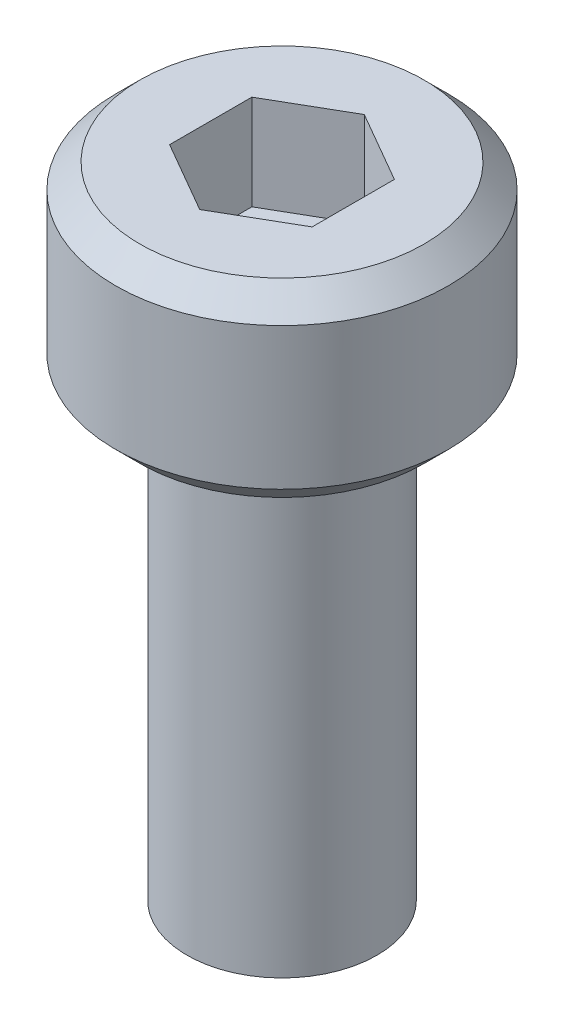
from build123d import *

# Parameters (mm, degrees)
SKETCH1_W           = 3.5
SKETCH1_H           = 3.999992
SKETCH2_R           = 2
BOSS_EXTRUDE1_DEPTH = 10
CUT_EXTRUDE1_DEPTH  = 2
CHAMFER1_SIZE       = 0.508
CHAMFER2_SIZE       = 0.76962
CHAMFER2_SIZE2      = 0.53848


with BuildPart() as part:
    # Sketch1 → Revolve1 (revolve)
    with BuildSketch(Plane.XY):
        with Locations((1.75, 1.999996)):
            Rectangle(SKETCH1_W, SKETCH1_H)
    revolve(axis=Axis((0, 3.999992, 0), (0, -1, 0)))

    # Sketch2 → Boss-Extrude1 (add)
    with BuildSketch(Plane.XZ):
        Circle(SKETCH2_R)
    extrude(amount=BOSS_EXTRUDE1_DEPTH)

    # Sketch3 → Cut-Extrude1 (cut)
    with BuildSketch(Plane(origin=(0, 3.999992, 0), x_dir=(-1, 0, 0), z_dir=(0, 1, 0))):
        Polygon((-1.5, -0.866025404), (0, -1.732050808), (1.5, -0.866025404), (1.5, 0.866025404), (0, 1.732050808), (-1.5, 0.866025404), align=None)
    extrude(amount=-CUT_EXTRUDE1_DEPTH, mode=Mode.SUBTRACT)

    # Chamfer1
    chamfer1_edges = [part.edges().sort_by_distance(p)[0] for p in [
        (-3.5, 0, 0),
        (-3.5, 3.999992, 0),
    ]]
    chamfer(chamfer1_edges, length=CHAMFER1_SIZE)

    # Chamfer2
    chamfer2_edges = [part.edges().sort_by_distance(p)[0] for p in [
        (-2, -10, 0),
    ]]
    chamfer2_side = [part.faces().sort_by_distance(p)[0] for p in [
        (0, -10, 0),
    ]]
    chamfer(chamfer2_edges, length=CHAMFER2_SIZE, length2=CHAMFER2_SIZE2, reference=chamfer2_side[0])


solid = part.part
